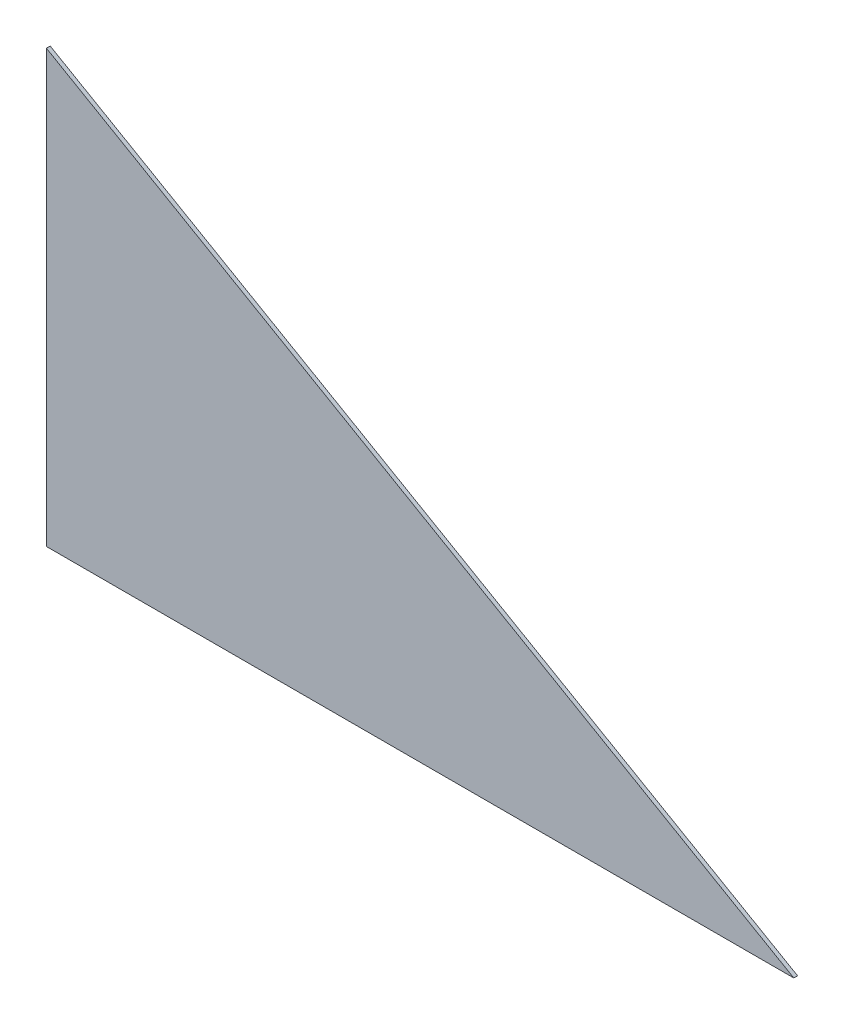
from build123d import *

# Parameters (mm, degrees)
BOSS_EXTRUDE1_DEPTH = 1.27


with BuildPart() as part:
    # Sketch1 → Boss-Extrude1 (new body)
    with BuildSketch(Plane.XY):
        Polygon((0, 0), (0, 144.337567297), (250, 0), align=None)
    extrude(amount=BOSS_EXTRUDE1_DEPTH)


solid = part.part
